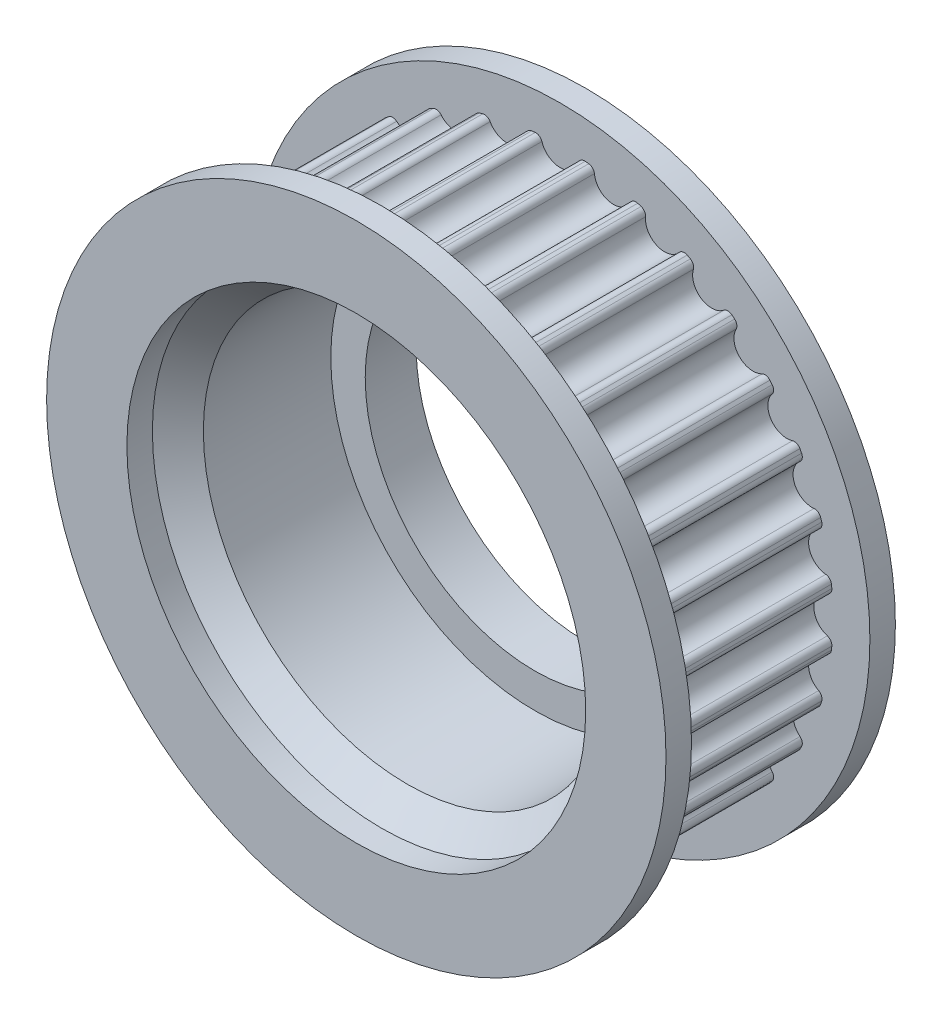
from build123d import *

# Parameters (mm, degrees)
ESBO_O1_R                = 8
RESSALTO_EXTRUS_O1_DEPTH = 7
FILETE1_R                = 0.25
CHANFRO1_SIZE            = 1
ESBO_O2_R                = 8
ESBO_O2_R_2              = 6.65
RESSALTO_EXTRUS_O2_DEPTH = 1
RESSALTO_EXTRUS_O3_START = 1
ESBO_O3_R                = 12.15
ESBO_O3_R_2              = 6.65
RESSALTO_EXTRUS_O3_DEPTH = 1
ESBO_O4_R                = 12.15
ESBO_O4_R_2              = 9
RESSALTO_EXTRUS_O4_DEPTH = 1


with BuildPart() as part:
    # Esboço1 → Ressalto-extrusão1 (new body)
    with BuildSketch(Plane.XY):
        with BuildLine():
            ThreePointArc((-0.749539256, -10.673714953), (0, -9.95), (0.749539256, -10.673714953))
            ThreePointArc((0.749539256, -10.673714953), (1.048783402, -10.648476575), (1.347201418, -10.614850368))
            ThreePointArc((1.347201418, -10.614850368), (1.941148704, -9.75881354), (2.817475557, -10.322394659))
            ThreePointArc((2.817475557, -10.322394659), (3.106046047, -10.239261592), (3.392169897, -10.148063036))
            ThreePointArc((3.392169897, -10.148063036), (3.807700152, -9.192601348), (4.777137852, -9.574390526))
            ThreePointArc((4.777137852, -9.574390526), (5.043945084, -9.436557529), (5.306779189, -9.291291333))
            ThreePointArc((5.306779189, -9.291291333), (5.527923819, -8.273122642), (6.553217418, -8.458447935))
            ThreePointArc((6.553217418, -8.458447935), (6.788008141, -8.271211851), (7.017451933, -8.077460515))
            ThreePointArc((7.017451933, -8.077460515), (7.035712473, -7.035712473), (8.077460515, -7.017451933))
            ThreePointArc((8.077460515, -7.017451933), (8.271211851, -6.788008141), (8.458447935, -6.553217418))
            ThreePointArc((8.458447935, -6.553217418), (8.273122642, -5.527923819), (9.291291333, -5.306779189))
            ThreePointArc((9.291291333, -5.306779189), (9.436557529, -5.043945084), (9.574390526, -4.777137852))
            ThreePointArc((9.574390526, -4.777137852), (9.192601348, -3.807700152), (10.148063036, -3.392169897))
            ThreePointArc((10.148063036, -3.392169897), (10.239261592, -3.106046047), (10.322394659, -2.817475557))
            ThreePointArc((10.322394659, -2.817475557), (9.75881354, -1.941148704), (10.614850368, -1.347201418))
            ThreePointArc((10.614850368, -1.347201418), (10.648476575, -1.048783402), (10.673714953, -0.749539256))
            ThreePointArc((10.673714953, -0.749539256), (9.95, 0), (10.673714953, 0.749539256))
            ThreePointArc((10.673714953, 0.749539256), (10.648476575, 1.048783402), (10.614850368, 1.347201418))
            ThreePointArc((10.614850368, 1.347201418), (9.75881354, 1.941148704), (10.322394659, 2.817475557))
            ThreePointArc((10.322394659, 2.817475557), (10.239261592, 3.106046047), (10.148063036, 3.392169897))
            ThreePointArc((10.148063036, 3.392169897), (9.192601348, 3.807700152), (9.574390526, 4.777137852))
            ThreePointArc((9.574390526, 4.777137852), (9.436557529, 5.043945084), (9.291291333, 5.306779189))
            ThreePointArc((9.291291333, 5.306779189), (8.273122642, 5.527923819), (8.458447935, 6.553217418))
            ThreePointArc((8.458447935, 6.553217418), (8.271211851, 6.788008141), (8.077460515, 7.017451933))
            ThreePointArc((8.077460515, 7.017451933), (7.035712473, 7.035712473), (7.017451933, 8.077460515))
            ThreePointArc((7.017451933, 8.077460515), (6.788008141, 8.271211851), (6.553217418, 8.458447935))
            ThreePointArc((6.553217418, 8.458447935), (5.527923819, 8.273122642), (5.306779189, 9.291291333))
            ThreePointArc((5.306779189, 9.291291333), (5.043945084, 9.436557529), (4.777137852, 9.574390526))
            ThreePointArc((4.777137852, 9.574390526), (3.807700152, 9.192601348), (3.392169897, 10.148063036))
            ThreePointArc((3.392169897, 10.148063036), (3.106046047, 10.239261592), (2.817475557, 10.322394659))
            ThreePointArc((2.817475557, 10.322394659), (1.941148704, 9.75881354), (1.347201418, 10.614850368))
            ThreePointArc((1.347201418, 10.614850368), (1.048783402, 10.648476575), (0.749539256, 10.673714953))
            ThreePointArc((0.749539256, 10.673714953), (0, 9.95), (-0.749539256, 10.673714953))
            ThreePointArc((-0.749539256, 10.673714953), (-1.048783402, 10.648476575), (-1.347201418, 10.614850368))
            ThreePointArc((-1.347201418, 10.614850368), (-1.941148704, 9.75881354), (-2.817475557, 10.322394659))
            ThreePointArc((-2.817475557, 10.322394659), (-3.106046047, 10.239261592), (-3.392169897, 10.148063036))
            ThreePointArc((-3.392169897, 10.148063036), (-3.807700152, 9.192601348), (-4.777137852, 9.574390526))
            ThreePointArc((-4.777137852, 9.574390526), (-5.043945084, 9.436557529), (-5.306779189, 9.291291333))
            ThreePointArc((-5.306779189, 9.291291333), (-5.527923819, 8.273122642), (-6.553217418, 8.458447935))
            ThreePointArc((-6.553217418, 8.458447935), (-6.788008141, 8.271211851), (-7.017451933, 8.077460515))
            ThreePointArc((-7.017451933, 8.077460515), (-7.035712473, 7.035712473), (-8.077460515, 7.017451933))
            ThreePointArc((-8.077460515, 7.017451933), (-8.271211851, 6.788008141), (-8.458447935, 6.553217418))
            ThreePointArc((-8.458447935, 6.553217418), (-8.273122642, 5.527923819), (-9.291291333, 5.306779189))
            ThreePointArc((-9.291291333, 5.306779189), (-9.436557529, 5.043945084), (-9.574390526, 4.777137852))
            ThreePointArc((-9.574390526, 4.777137852), (-9.192601348, 3.807700152), (-10.148063036, 3.392169897))
            ThreePointArc((-10.148063036, 3.392169897), (-10.239261592, 3.106046047), (-10.322394659, 2.817475557))
            ThreePointArc((-10.322394659, 2.817475557), (-9.75881354, 1.941148704), (-10.614850368, 1.347201418))
            ThreePointArc((-10.614850368, 1.347201418), (-10.648476575, 1.048783402), (-10.673714953, 0.749539256))
            ThreePointArc((-10.673714953, 0.749539256), (-9.95, 0), (-10.673714953, -0.749539256))
            ThreePointArc((-10.673714953, -0.749539256), (-10.648476575, -1.048783402), (-10.614850368, -1.347201418))
            ThreePointArc((-10.614850368, -1.347201418), (-9.75881354, -1.941148704), (-10.322394659, -2.817475557))
            ThreePointArc((-10.322394659, -2.817475557), (-10.239261592, -3.106046047), (-10.148063036, -3.392169897))
            ThreePointArc((-10.148063036, -3.392169897), (-9.192601348, -3.807700152), (-9.574390526, -4.777137852))
            ThreePointArc((-9.574390526, -4.777137852), (-9.436557529, -5.043945084), (-9.291291333, -5.306779189))
            ThreePointArc((-9.291291333, -5.306779189), (-8.273122642, -5.527923819), (-8.458447935, -6.553217418))
            ThreePointArc((-8.458447935, -6.553217418), (-8.271211851, -6.788008141), (-8.077460515, -7.017451933))
            ThreePointArc((-8.077460515, -7.017451933), (-7.035712473, -7.035712473), (-7.017451933, -8.077460515))
            ThreePointArc((-7.017451933, -8.077460515), (-6.788008141, -8.271211851), (-6.553217418, -8.458447935))
            ThreePointArc((-6.553217418, -8.458447935), (-5.527923819, -8.273122642), (-5.306779189, -9.291291333))
            ThreePointArc((-5.306779189, -9.291291333), (-5.043945084, -9.436557529), (-4.777137852, -9.574390526))
            ThreePointArc((-4.777137852, -9.574390526), (-3.807700152, -9.192601348), (-3.392169897, -10.148063036))
            ThreePointArc((-3.392169897, -10.148063036), (-3.106046047, -10.239261592), (-2.817475557, -10.322394659))
            ThreePointArc((-2.817475557, -10.322394659), (-1.941148704, -9.75881354), (-1.347201418, -10.614850368))
            ThreePointArc((-1.347201418, -10.614850368), (-1.048783402, -10.648476575), (-0.749539256, -10.673714953))
        make_face()
        Circle(ESBO_O1_R, mode=Mode.SUBTRACT)
    extrude(amount=RESSALTO_EXTRUS_O1_DEPTH)

    # Filete1
    filete1_edges = [part.edges().sort_by_distance(p)[0] for p in [
        (1.347201418, -10.614850368, 3.5),
        (0.749539256, -10.673714953, 3.5),
        (-0.749539256, -10.673714953, 3.5),
        (-1.347201418, -10.614850368, 3.5),
        (-2.817475557, -10.322394659, 3.5),
        (-3.392169897, -10.148063036, 3.5),
        (-4.777137852, -9.574390526, 3.5),
        (-5.306779189, -9.291291333, 3.5),
        (-6.553217418, -8.458447935, 3.5),
        (-7.017451933, -8.077460515, 3.5),
        (-8.077460515, -7.017451933, 3.5),
        (-8.458447935, -6.553217418, 3.5),
        (-9.291291333, -5.306779189, 3.5),
        (-9.574390526, -4.777137852, 3.5),
        (-10.148063036, -3.392169897, 3.5),
        (-10.322394659, -2.817475557, 3.5),
        (-10.614850368, -1.347201418, 3.5),
        (-10.673714953, -0.749539256, 3.5),
        (-10.673714953, 0.749539256, 3.5),
        (-10.614850368, 1.347201418, 3.5),
        (-10.322394659, 2.817475557, 3.5),
        (-10.148063036, 3.392169897, 3.5),
        (-9.574390526, 4.777137852, 3.5),
        (-9.291291333, 5.306779189, 3.5),
        (-8.458447935, 6.553217418, 3.5),
        (-8.077460515, 7.017451933, 3.5),
        (-7.017451933, 8.077460515, 3.5),
        (-6.553217418, 8.458447935, 3.5),
        (-5.306779189, 9.291291333, 3.5),
        (-4.777137852, 9.574390526, 3.5),
        (-3.392169897, 10.148063036, 3.5),
        (-2.817475557, 10.322394659, 3.5),
        (-1.347201418, 10.614850368, 3.5),
        (-0.749539256, 10.673714953, 3.5),
        (0.749539256, 10.673714953, 3.5),
        (1.347201418, 10.614850368, 3.5),
        (2.817475557, 10.322394659, 3.5),
        (3.392169897, 10.148063036, 3.5),
        (4.777137852, 9.574390526, 3.5),
        (5.306779189, 9.291291333, 3.5),
        (6.553217418, 8.458447935, 3.5),
        (7.017451933, 8.077460515, 3.5),
        (8.077460515, 7.017451933, 3.5),
        (8.458447935, 6.553217418, 3.5),
        (9.291291333, 5.306779189, 3.5),
        (9.574390526, 4.777137852, 3.5),
        (10.148063036, 3.392169897, 3.5),
        (10.322394659, 2.817475557, 3.5),
        (10.614850368, 1.347201418, 3.5),
        (10.673714953, 0.749539256, 3.5),
        (10.673714953, -0.749539256, 3.5),
        (10.614850368, -1.347201418, 3.5),
        (10.322394659, -2.817475557, 3.5),
        (10.148063036, -3.392169897, 3.5),
        (9.574390526, -4.777137852, 3.5),
        (9.291291333, -5.306779189, 3.5),
        (8.458447935, -6.553217418, 3.5),
        (8.077460515, -7.017451933, 3.5),
        (7.017451933, -8.077460515, 3.5),
        (6.553217418, -8.458447935, 3.5),
        (5.306779189, -9.291291333, 3.5),
        (4.777137852, -9.574390526, 3.5),
        (3.392169897, -10.148063036, 3.5),
        (2.817475557, -10.322394659, 3.5),
    ]]
    fillet(filete1_edges, radius=FILETE1_R)

    # Chanfro1
    chanfro1_edges = [part.edges().sort_by_distance(p)[0] for p in [
        (-8, 0, 7),
    ]]
    chamfer(chanfro1_edges, length=CHANFRO1_SIZE)

    # Esboço2 → Ressalto-extrusão2 (add)
    with BuildSketch(Plane(origin=(0, 0, 0), x_dir=(-1, 0, 0), z_dir=(0, 0, -1))):
        Circle(ESBO_O2_R)
        Circle(ESBO_O2_R_2, mode=Mode.SUBTRACT)
    extrude(amount=-RESSALTO_EXTRUS_O2_DEPTH)

    # Esboço3 → Ressalto-extrusão3 (add)
    with BuildSketch(Plane(origin=(0, 0, 0), x_dir=(-1, 0, 0), z_dir=(0, 0, -1)).offset(RESSALTO_EXTRUS_O3_START)):
        Circle(ESBO_O3_R)
        Circle(ESBO_O3_R_2, mode=Mode.SUBTRACT)
    extrude(amount=-RESSALTO_EXTRUS_O3_DEPTH)

    # Esboço4 → Ressalto-extrusão4 (add)
    with BuildSketch(Plane.XY.offset(7)):
        with Locations(Location((0, 0, 0), (0, 0, 180))):
            Circle(ESBO_O4_R)
        Circle(ESBO_O4_R_2, mode=Mode.SUBTRACT)
    extrude(amount=RESSALTO_EXTRUS_O4_DEPTH)


solid = part.part
